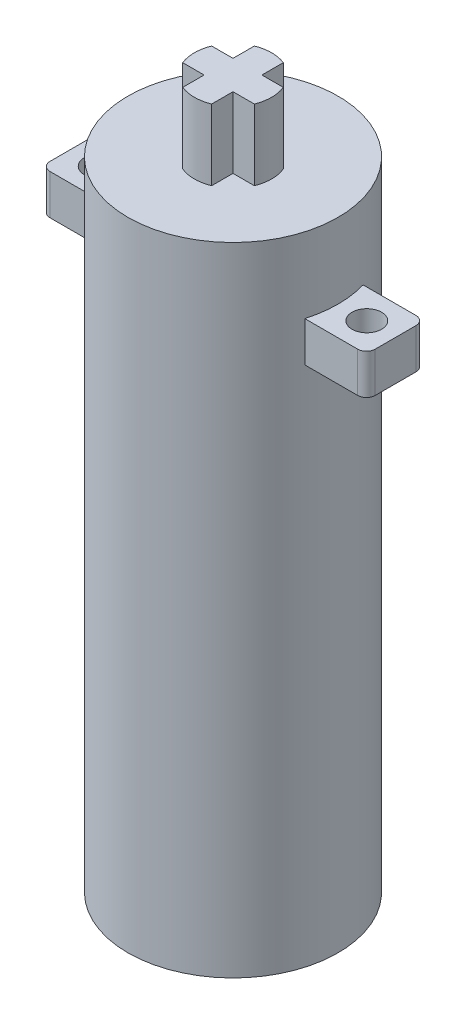
from build123d import *

# Parameters (mm, degrees)
VIGORSKETCH_R        = 0.8449945
VIGORFLANGE_DEPTH    = 2.2900005
VIGORFLANGE_2_DEPTH  = 2.2900005
VIGORAXLE_DEPTH      = 10.619994
VIGORBODY_DEPTH      = 6.579997
VIGORBODY_DEPTH_BACK = 29.78994804
VIGORSKETCH_8_R      = 6.0000007


with BuildPart() as part:
    # VigorSketch → VigorFlange (new body)
    with BuildSketch(Plane(origin=(0, 0, 0), x_dir=(1, 0, 0), z_dir=(0, 1, 0))):
        with BuildLine():
            ThreePointArc((-1.445618439, -1.6649954), (-2.2049994, 0), (-1.445618439, 1.6649954))
            Line((-1.445618439, 1.6649954), (-8.7849954, 1.6649954))
            ThreePointArc((-8.7849954, 1.6649954), (-9.138548791, 1.518548791), (-9.2849954, 1.1649954))
            Line((-9.2849954, 1.1649954), (-9.2849954, -1.1649954))
            ThreePointArc((-9.2849954, -1.1649954), (-9.138548791, -1.518548791), (-8.7849954, -1.6649954))
            Line((-8.7849954, -1.6649954), (-1.445618439, -1.6649954))
        make_face()
        with Locations((-7.64249678, 0)):
            Circle(VIGORSKETCH_R, mode=Mode.SUBTRACT)
    extrude(amount=VIGORFLANGE_DEPTH)



with BuildPart() as body_2:
    # VigorSketch → VigorFlange 2 (new body)
    with BuildSketch(Plane(origin=(0, 0, 0), x_dir=(1, 0, 0), z_dir=(0, 1, 0))):
        with BuildLine():
            Line((1.445618439, -1.6649954), (8.7849954, -1.6649954))
            ThreePointArc((8.7849954, -1.6649954), (9.138548791, -1.518548791), (9.2849954, -1.1649954))
            Line((9.2849954, -1.1649954), (9.2849954, 1.1649954))
            ThreePointArc((9.2849954, 1.1649954), (9.138548791, 1.518548791), (8.7849954, 1.6649954))
            Line((8.7849954, 1.6649954), (1.445618439, 1.6649954))
            ThreePointArc((1.445618439, 1.6649954), (2.2049994, 0), (1.445618439, -1.6649954))
        make_face()
        with Locations((7.64249678, 0)):
            Circle(VIGORSKETCH_R, mode=Mode.SUBTRACT)
    extrude(amount=VIGORFLANGE_2_DEPTH)


with BuildPart() as part_1:
    add(part.part)

    add(body_2.part)  # VigorAxle merges body 2
    # Sketch1<7> → VigorAxle (add)
    with BuildSketch(Plane(origin=(0, 0, 0), x_dir=(1, 0, 0), z_dir=(0, 1, 0))):
        with BuildLine():
            Line((-0.824890579, -0.824890579), (-0.824890579, -2.044890679))
            ThreePointArc((-0.824890579, -2.044890679), (0, -2.2049994), (0.824890579, -2.044890679))
            Line((0.824890579, -2.044890679), (0.824890579, -0.824890579))
            Line((0.824890579, -0.824890579), (2.044890679, -0.824890579))
            ThreePointArc((2.044890679, -0.824890579), (2.2049994, 0), (2.044890679, 0.824890579))
            Line((2.044890679, 0.824890579), (0.824890579, 0.824890579))
            Line((0.824890579, 0.824890579), (0.824890579, 2.044890679))
            ThreePointArc((0.824890579, 2.044890679), (0, 2.2049994), (-0.824890579, 2.044890679))
            Line((-0.824890579, 2.044890679), (-0.824890579, 0.824890579))
            Line((-0.824890579, 0.824890579), (-2.044890679, 0.824890579))
            ThreePointArc((-2.044890679, 0.824890579), (-2.2049994, 0), (-2.044890679, -0.824890579))
            Line((-2.044890679, -0.824890579), (-0.824890579, -0.824890579))
        make_face()
    extrude(amount=VIGORAXLE_DEPTH)

    # VigorSketch<8> → VigorBody (add, two sides: drawn at the far end of the back side and taken through both)
    with BuildSketch(Plane(origin=(0, 0, 0), x_dir=(1, 0, 0), z_dir=(0, 1, 0)).offset(-VIGORBODY_DEPTH_BACK)):
        Circle(VIGORSKETCH_8_R)
    extrude(amount=VIGORBODY_DEPTH + VIGORBODY_DEPTH_BACK)


solid = part_1.part
